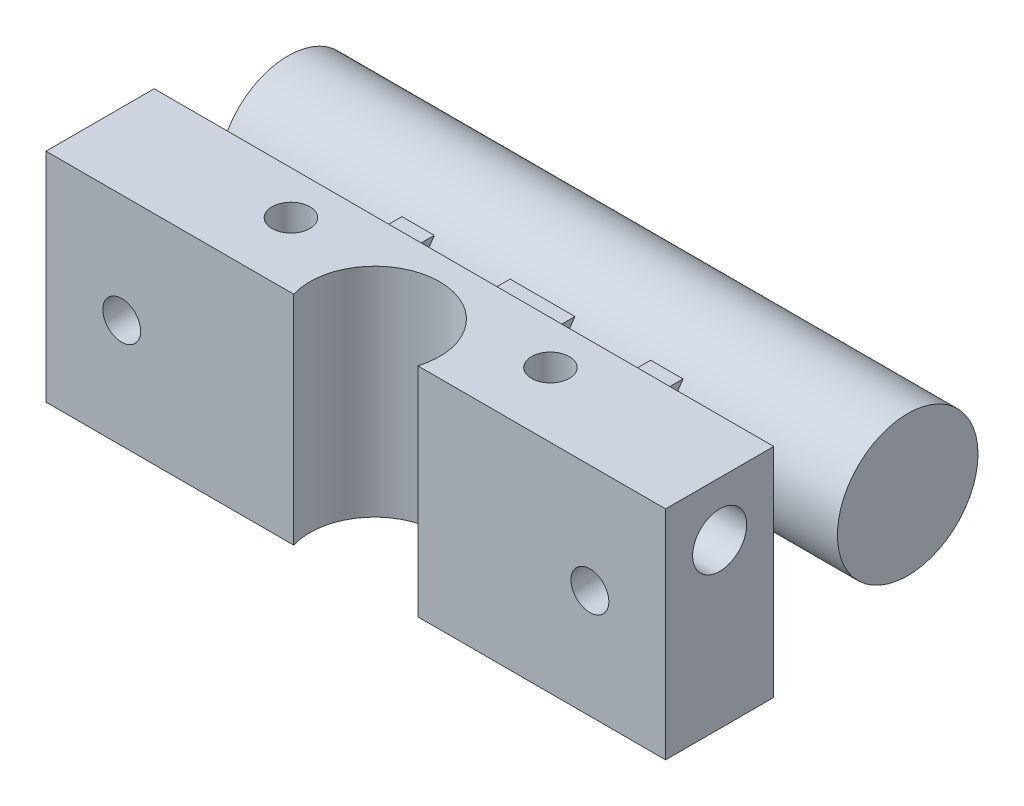
from build123d import *

# Parameters (mm, degrees)
SKETCH1_W                = 57.3
SKETCH1_H                = 20.1
BOSS_EXTRUDE1_DEPTH      = 10
SKETCH2_W                = 3
SKETCH2_H                = 8
SKETCH2_W_2              = 6
BOSS_EXTRUDE2_DEPTH      = 20
SKETCH3_R                = 2.5
SKETCH3_R_2              = 1.75
BOSS_EXTRUDE3_DEPTH      = 4
BOSS_EXTRUDE4_START      = -9
SKETCH3_3_R              = 2.5
SKETCH3_3_R_2            = 1.75
BOSS_EXTRUDE4_DEPTH      = 8
CUT_EXTRUDE1_DEPTH       = 53.304158534
CUT_EXTRUDE1_DEPTH_BACK  = 53.304158534
SKETCH3_4_R              = 1.75
CUT_EXTRUDE2_DEPTH       = 35.503001319
CUT_EXTRUDE2_DEPTH_BACK  = 35.503001319
SKETCH4_R                = 1.75
CUT_EXTRUDE3_DEPTH       = 44.832232432
CUT_EXTRUDE3_DEPTH_BACK  = 44.832232432
SKETCH6_R                = 1.75
SKETCH6_R_2              = 6
SKETCH7_R                = 2.5
CUT_EXTRUDE4_DEPTH       = 10
BOSS_EXTRUDE6_DEPTH      = 15.65
BOSS_EXTRUDE6_DEPTH_BACK = 41.65
SKETCH5_R                = 6.5


with BuildPart() as part:
    # Sketch1 → Boss-Extrude1 (new body)
    with BuildSketch(Plane.XY):
        Rectangle(SKETCH1_W, SKETCH1_H)
    extrude(amount=-BOSS_EXTRUDE1_DEPTH)

    # Sketch2 → Boss-Extrude2 (add)
    with BuildSketch(Plane(origin=(0, 0, -10), x_dir=(-1, 0, 0), z_dir=(0, 0, -1))):
        with Locations((-11.5, 0)):
            Rectangle(SKETCH2_W, SKETCH2_H)
        Rectangle(SKETCH2_W_2, SKETCH2_H)
        with Locations((11.5, 0)):
            Rectangle(SKETCH2_W, SKETCH2_H)
    extrude(amount=BOSS_EXTRUDE2_DEPTH)

    # Sketch3 → Boss-Extrude3 (add)
    with BuildSketch(Plane(origin=(13, 0, 0), x_dir=(0, 0, -1), z_dir=(1, 0, 0))):
        with Locations((22.39, 0)):
            Circle(SKETCH3_R)
        with Locations((22.39, 0)):
            Circle(SKETCH3_R_2, mode=Mode.SUBTRACT)
    boss_extrude3 = extrude(amount=-BOSS_EXTRUDE3_DEPTH)

    # Sketch3<3> → Boss-Extrude4 (add)
    with BuildSketch(Plane(origin=(13, 0, 0), x_dir=(0, 0, -1), z_dir=(1, 0, 0)).offset(BOSS_EXTRUDE4_START)):
        with Locations((22.39, 0)):
            Circle(SKETCH3_3_R)
        with Locations((22.39, 0)):
            Circle(SKETCH3_3_R_2, mode=Mode.SUBTRACT)
    extrude(amount=-BOSS_EXTRUDE4_DEPTH)

    # Mirror1: Boss-Extrude3 across plane
    add(boss_extrude3.mirror(Plane(origin=(0, 0, 0), x_dir=(0, 0, 1), z_dir=(1, 0, 0))))

    # Sketch3<4> → Cut-Extrude1 (cut, two sides: drawn at the far end of the back side and taken through both)
    with BuildSketch(Plane(origin=(13, 0, 0), x_dir=(0, 0, -1), z_dir=(1, 0, 0)).offset(-CUT_EXTRUDE1_DEPTH_BACK)):
        with Locations((22.39, 0)):
            Circle(SKETCH3_4_R)
        with BuildLine():
            Line((30, 4), (22.39, 4))
            ThreePointArc((22.39, 4), (25.218427125, 2.828427125), (26.39, 0))
            ThreePointArc((26.39, 0), (25.218427125, -2.828427125), (22.39, -4))
            Line((22.39, -4), (30, -4))
            Line((30, -4), (30, 4))
        make_face()
    extrude(amount=CUT_EXTRUDE1_DEPTH + CUT_EXTRUDE1_DEPTH_BACK, mode=Mode.SUBTRACT)

    # Sketch4 → Cut-Extrude2 (cut, two sides: drawn at the far end of the back side and taken through both)
    with BuildSketch(Plane(origin=(0, 0, -10), x_dir=(-1, 0, 0), z_dir=(0, 0, -1)).offset(-CUT_EXTRUDE2_DEPTH_BACK)):
        with Locations((-21.65, 0)):
            Circle(SKETCH4_R)
        with Locations((21.65, 0)):
            Circle(SKETCH4_R)
    extrude(amount=CUT_EXTRUDE2_DEPTH + CUT_EXTRUDE2_DEPTH_BACK, mode=Mode.SUBTRACT)

    # Sketch6 → Cut-Extrude3 (cut, two sides: drawn at the far end of the back side and taken through both)
    with BuildSketch(Plane(origin=(0, 10.05, 0), x_dir=(1, 0, 0), z_dir=(0, 1, 0)).offset(-CUT_EXTRUDE3_DEPTH_BACK)):
        with Locations(Location((-12, 6, 0), (0, 0, 270))):
            Circle(SKETCH6_R)
        with Locations(Location((12, 6, 0), (0, 0, 270))):
            Circle(SKETCH6_R)
        with Locations((0, 1.75)):
            Circle(SKETCH6_R_2)
    extrude(amount=CUT_EXTRUDE3_DEPTH + CUT_EXTRUDE3_DEPTH_BACK, mode=Mode.SUBTRACT)

    # Sketch7 → Cut-Extrude4 (cut)
    with BuildSketch(Plane(origin=(28.65, 0, 0), x_dir=(0, 0, -1), z_dir=(1, 0, 0))):
        with Locations((5, 5.05)):
            Circle(SKETCH7_R)
    cut_extrude4 = extrude(amount=-CUT_EXTRUDE4_DEPTH, mode=Mode.SUBTRACT)

    # Mirror2: Cut-Extrude4 across plane
    add(cut_extrude4.mirror(Plane(origin=(0, 0, 0), x_dir=(0, 0, 1), z_dir=(1, 0, 0))), mode=Mode.SUBTRACT)

    # Sketch5 → Boss-Extrude6 (add, two sides: drawn at the far end of the back side and taken through both)
    with BuildSketch(Plane(origin=(13, 0, 0), x_dir=(0, 0, -1), z_dir=(1, 0, 0)).offset(-BOSS_EXTRUDE6_DEPTH_BACK)):
        with Locations((22.39, 0)):
            Circle(SKETCH5_R)
    extrude(amount=BOSS_EXTRUDE6_DEPTH + BOSS_EXTRUDE6_DEPTH_BACK)


solid = part.part
